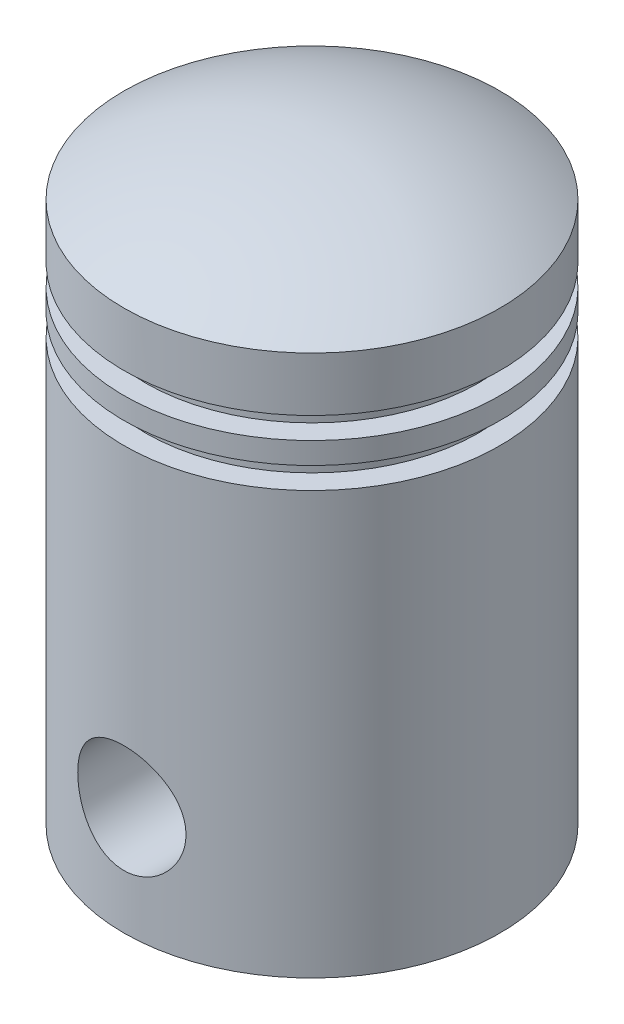
from build123d import *

# Parameters (mm, degrees)
SKETCH3_R               = 17.375
BOSS_EXTRUDE1_DEPTH     = 30
SKETCH4_R               = 17.375
BOSS_EXTRUDE2_DEPTH     = 20
CUT_EXTRUDE1_DEPTH      = 61
CUT_EXTRUDE1_DEPTH_BACK = 42
SKETCH5_R               = 5
CUT_EXTRUDE3_DEPTH      = 15
SKETCH13_W              = 24.75
SKETCH13_H              = 10.5
CUT_EXTRUDE4_DEPTH      = 9
DOME1_FACE_RADIUS       = 17.375
DOME1_HEIGHT            = 5
SKETCH16_W              = 2
SKETCH16_H              = 2


with BuildPart() as part:
    # Sketch3 → Boss-Extrude1 (new body)
    with BuildSketch(Plane(origin=(0, 0, 0), x_dir=(1, 0, 0), z_dir=(0, 1, 0))):
        with Locations(Location((0, 0, 0), (0, 0, 270))):
            Circle(SKETCH3_R)
    extrude(amount=BOSS_EXTRUDE1_DEPTH)

    # Sketch4 → Boss-Extrude2 (add)
    with BuildSketch(Plane(origin=(0, 30, 0), x_dir=(1, 0, 0), z_dir=(0, 1, 0))):
        with Locations(Location((0, 0, 0), (0, 0, 270))):
            Circle(SKETCH4_R)
    extrude(amount=BOSS_EXTRUDE2_DEPTH)

    # Sketch5 → Cut-Extrude1 (cut, two sides: drawn at the far end of the back side and taken through both)
    with BuildSketch(Plane.XY.offset(-CUT_EXTRUDE1_DEPTH_BACK)):
        with Locations(Location((0, 10, 0), (0, 0, 90.000000029))):
            Circle(SKETCH5_R)
    extrude(amount=CUT_EXTRUDE1_DEPTH + CUT_EXTRUDE1_DEPTH_BACK, mode=Mode.SUBTRACT)

    # Sketch7 → Cut-Extrude3 (cut)
    with BuildSketch(Plane.XZ):
        Polygon((0, 0), (0, 5.25), (-12.375, 5.25), (-12.375, -5.25), (0, -5.25), align=None)
        Polygon((12.375, 5.25), (0, 5.25), (0, 0), (0, -5.25), (12.375, -5.25), align=None)
    extrude(amount=-CUT_EXTRUDE3_DEPTH, mode=Mode.SUBTRACT)

    # Sketch13 → Cut-Extrude4 (cut)
    with BuildSketch(Plane.XZ.offset(-15)):
        Rectangle(SKETCH13_W, SKETCH13_H)
    extrude(amount=-CUT_EXTRUDE4_DEPTH, mode=Mode.SUBTRACT)

    # Dome1: a dome of height H over a round flat face of radius A is a cap of a sphere of radius (A * A + H * H) / (2 * H)
    dome1_r = (DOME1_FACE_RADIUS * DOME1_FACE_RADIUS + DOME1_HEIGHT * DOME1_HEIGHT) / (2 * DOME1_HEIGHT)
    dome1_base = Plane((0, 50, 0), z_dir=(0, 1, 0))
    with Locations(dome1_base.offset(DOME1_HEIGHT - dome1_r)):
        dome1_ball = Sphere(dome1_r, mode=Mode.PRIVATE)
    add(split(dome1_ball, bisect_by=dome1_base, keep=Keep.TOP, mode=Mode.PRIVATE))

    # Sketch16 → Cut-Revolve2 (revolve, cut)
    with BuildSketch(Plane.XY):
        with Locations((-16.375, 44)):
            Rectangle(SKETCH16_W, SKETCH16_H)
        with Locations((-16.375, 40)):
            Rectangle(SKETCH16_W, SKETCH16_H)
    revolve(axis=Axis((0, 55, 0), (0, -1, 0)), mode=Mode.SUBTRACT)


solid = part.part
